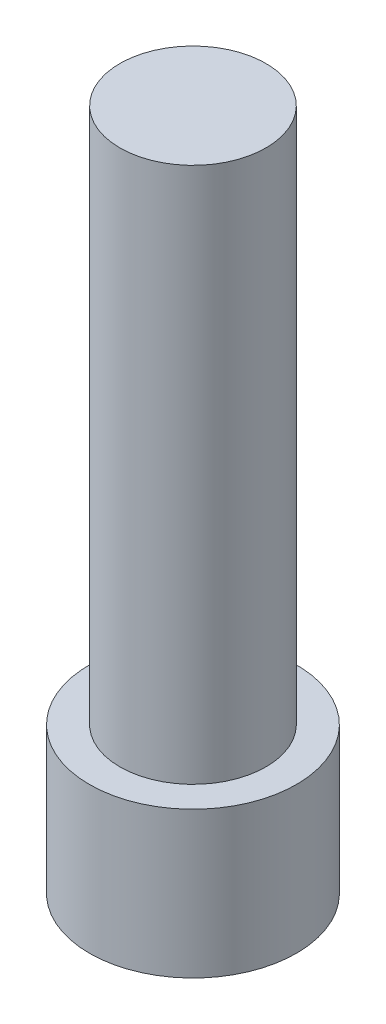
from build123d import *

# Parameters (mm, degrees)
SKETCH_1_R          = 4.25
EXTRUDE_1_DEPTH     = 6
SKETCH_2_R          = 3
EXTRUDE_2_DEPTH     = 22
CUT_EXTRUDE_1_DEPTH = 3


with BuildPart() as part:
    # 草图1 → 凸台-拉伸1 (new body)
    with BuildSketch(Plane(origin=(0, 0, 0), x_dir=(1, 0, 0), z_dir=(0, 1, 0))):
        with Locations(Location((0, 0, 0), (0, 0, 270))):
            Circle(SKETCH_1_R)
    extrude(amount=EXTRUDE_1_DEPTH)

    # 草图2 → 凸台-拉伸2 (add)
    with BuildSketch(Plane(origin=(0, 6, 0), x_dir=(1, 0, 0), z_dir=(0, 1, 0))):
        with Locations(Location((0, 0, 0), (0, 0, 270))):
            Circle(SKETCH_2_R)
    extrude(amount=EXTRUDE_2_DEPTH)

    # 草图3 → 切除-拉伸1 (cut)
    with BuildSketch(Plane.XZ):
        Polygon((2.357121757, -1.666526435), (2.621815107, 1.208064104), (0.26469335, 2.874590538), (-2.357121757, 1.666526435), (-2.621815107, -1.208064104), (-0.26469335, -2.874590538), align=None)
    extrude(amount=-CUT_EXTRUDE_1_DEPTH, mode=Mode.SUBTRACT)


solid = part.part
